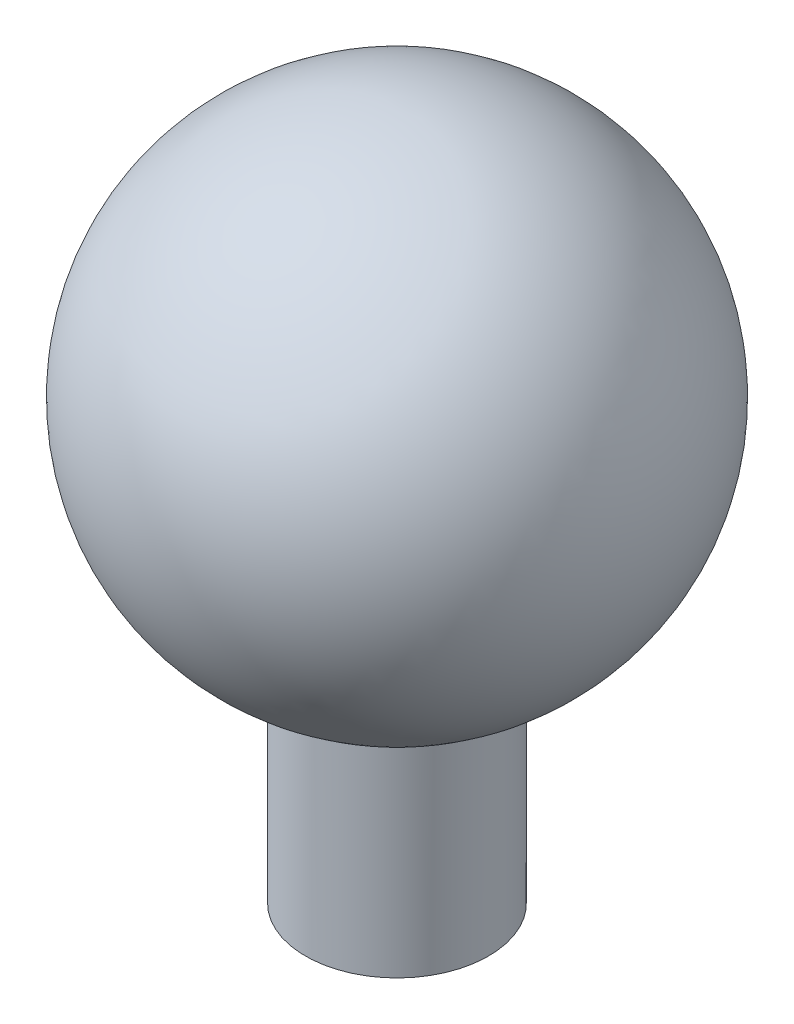
from build123d import *

# Parameters (mm, degrees)
SKETCH2_R          = 5
CUT_EXTRUDE1_DEPTH = 30


with BuildPart() as part:
    # Sketch1 → Revolve1 (revolve)
    with BuildSketch(Plane.XY, mode=Mode.PRIVATE) as revolve1_sk:
        with BuildLine():
            Line((0, 0), (-12, 0))
            Line((-12, 0), (-12, 27.296523379))
            ThreePointArc((-12, 27.296523379), (-31.920706369, 63.608887371), (0, 90))
            Line((0, 90), (0, 0))
        make_face()
    revolve(revolve1_sk.sketch.rotate(Axis((0, 0, 0), (0, 1, 0)), 180), axis=Axis((0, 0, 0), (0, 1, 0)))

    # Sketch2 → Cut-Extrude1 (cut)
    with BuildSketch(Plane(origin=(0, 0, 0), x_dir=(-1, 0, 0), z_dir=(0, -1, 0))):
        with Locations(Location((0, 0, 0), (0, 0, 90))):
            Circle(SKETCH2_R)
    extrude(amount=-CUT_EXTRUDE1_DEPTH, mode=Mode.SUBTRACT)


solid = part.part
